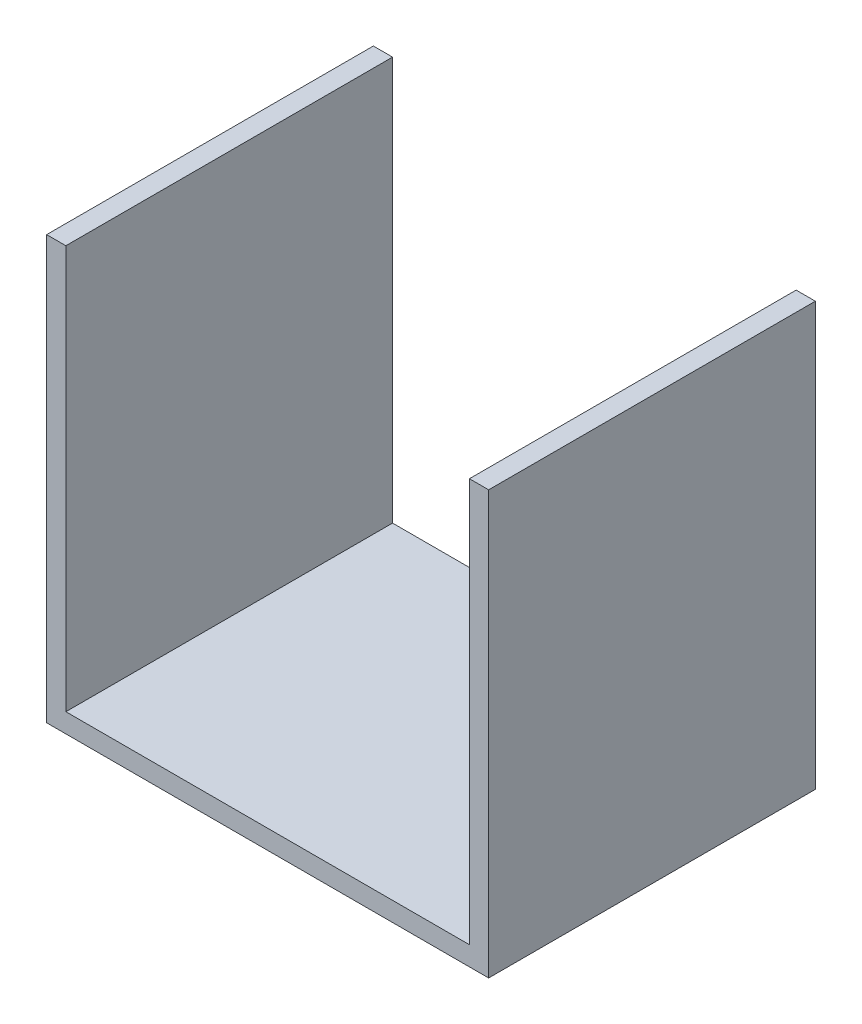
from build123d import *

# Parameters (mm, degrees)
EXTRUDE_1_DEPTH = 34


with BuildPart() as part:
    # 草图1 → 凸台-拉伸1 (new body)
    with BuildSketch(Plane.XY):
        Polygon((0, 42), (-2, 42), (-2, -2), (44, -2), (44, 42), (42, 42), (42, 0), (0, 0), align=None)
    extrude(amount=EXTRUDE_1_DEPTH)


solid = part.part
